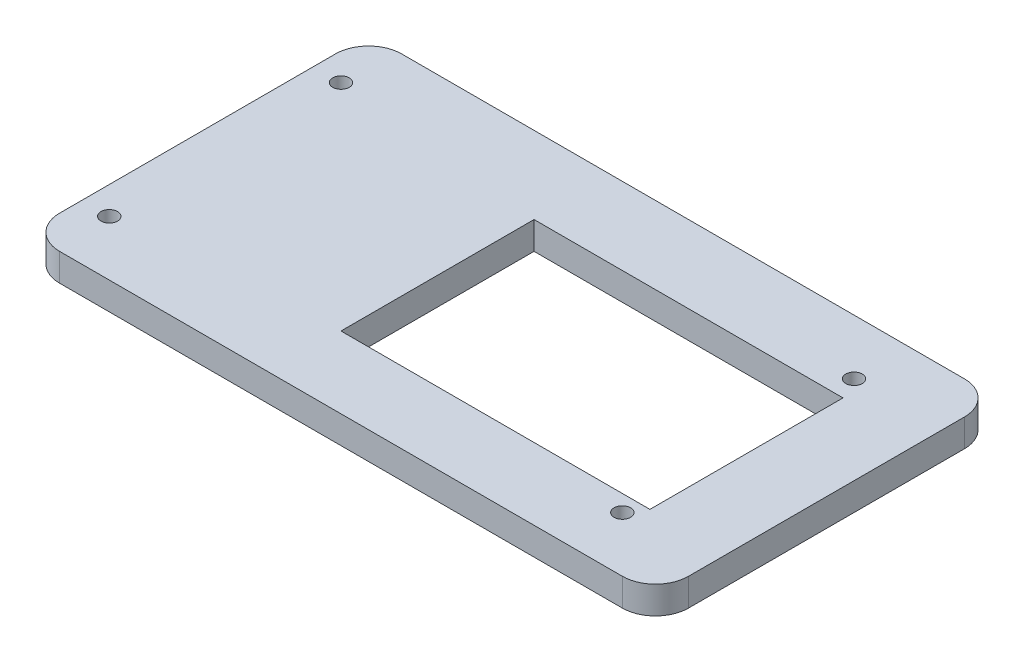
from build123d import *

# Parameters (mm, degrees)
SKETCH_1_W          = 56
SKETCH_1_H          = 35
EXTRUDE_1_DEPTH     = 5
SKETCH_3_R          = 1.5
CUT_EXTRUDE_1_DEPTH = 10
FILLET_1_R          = 6


with BuildPart() as part:
    # Эскиз1 → Бобышка-Вытянуть1 (new body)
    with BuildSketch(Plane(origin=(0, 0, 0), x_dir=(1, 0, 0), z_dir=(0, 1, 0))):
        Polygon((-31.5, -31), (-82.5, -31), (-82.5, 21), (-82.5, 31), (31.5, 31), (31.5, -31), align=None)
        with Locations((-10.5, -0.5)):
            Rectangle(SKETCH_1_W, SKETCH_1_H, mode=Mode.SUBTRACT)
    extrude(amount=EXTRUDE_1_DEPTH)

    # Эскиз3 → Вырез-Вытянуть1 (cut)
    with BuildSketch(Plane.XZ):
        with Locations(Location((15.5, 21, 0), (0, 0, 270))):
            Circle(SKETCH_3_R)
        with Locations(Location((15.5, -21, 0), (0, 0, 270))):
            Circle(SKETCH_3_R)
        with Locations(Location((-77.5, 21, 0), (0, 0, 270))):
            Circle(SKETCH_3_R)
        with Locations(Location((-77.5, -21, 0), (0, 0, 270))):
            Circle(SKETCH_3_R)
    extrude(amount=-CUT_EXTRUDE_1_DEPTH, mode=Mode.SUBTRACT)

    # Скругление1
    fillet_1_edges = [part.edges().sort_by_distance(p)[0] for p in [
        (-82.5, 2.5, 31),
        (-82.5, 2.5, -31),
        (31.5, 2.5, -31),
        (31.5, 2.5, 31),
    ]]
    fillet(fillet_1_edges, radius=FILLET_1_R)


solid = part.part
